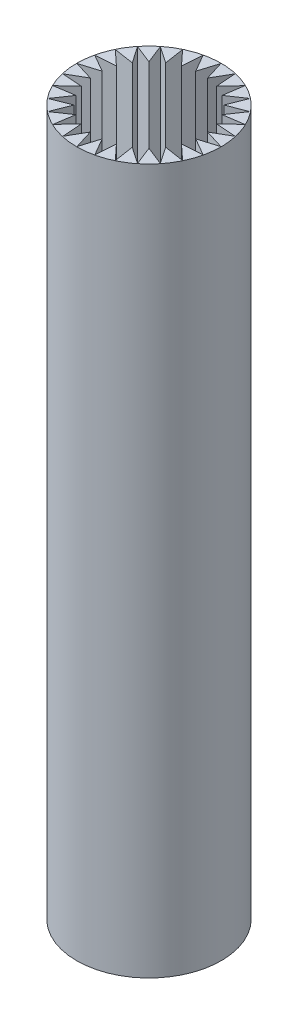
from build123d import *

# Parameters (mm, degrees)
SKETCH1_R           = 3.175
BOSS_EXTRUDE1_DEPTH = 18.000000068
SKETCH2_R           = 3.175
BOSS_EXTRUDE2_DEPTH = 0.254
SKETCH4_R           = 3.175
BOSS_EXTRUDE3_DEPTH = 12.7
CUT_EXTRUDE3_DEPTH  = 12.7


with BuildPart() as part:
    # Sketch1 → Boss-Extrude1 (new body)
    with BuildSketch(Plane(origin=(0, 0, 0), x_dir=(1, 0, 0), z_dir=(0, 1, 0))):
        with Locations(Location((0, 0, 0), (0, 0, 270))):
            Circle(SKETCH1_R)
        with BuildLine():
            Line((-1.855488288, -1.67829283), (1.855488288, -1.67829283))
            ThreePointArc((1.855488288, -1.67829283), (0, 2.5019), (-1.855488288, -1.67829283))
        make_face(mode=Mode.SUBTRACT)
    extrude(amount=BOSS_EXTRUDE1_DEPTH)

    # Sketch2 → Boss-Extrude2 (add)
    with BuildSketch(Plane(origin=(0, 18.000000068, 0), x_dir=(1, 0, 0), z_dir=(0, 1, 0))):
        with Locations(Location((0, 0, 0), (0, 0, 270))):
            Circle(SKETCH2_R)
    extrude(amount=BOSS_EXTRUDE2_DEPTH)

    # Sketch4 → Boss-Extrude3 (add)
    with BuildSketch(Plane(origin=(0, 18.254000068, 0), x_dir=(1, 0, 0), z_dir=(0, 1, 0))):
        with Locations(Location((0, 0, 0), (0, 0, 270))):
            Circle(SKETCH4_R)
    extrude(amount=BOSS_EXTRUDE3_DEPTH)

    # Sketch5 → Cut-Extrude3 (cut)
    with BuildSketch(Plane(origin=(0, 30.954000068, 0), x_dir=(1, 0, 0), z_dir=(0, 1, 0))):
        Polygon((0.703027733, 3.08016575), (0.260735719, 2.314093511), (0, 3.159377952), (-0.260735719, 2.314093511), (-0.703027733, 3.08016575), (-0.76913278, 2.1980552), (-1.370802719, 2.846501177), (-1.238962311, 1.971797222), (-1.969839933, 2.470101148), (-1.646665099, 1.646665099), (-2.470101148, 1.969839933), (-1.971797222, 1.238962311), (-2.846501177, 1.370802719), (-2.1980552, 0.76913278), (-3.08016575, 0.703027733), (-2.314093511, 0.260735719), (-3.159377952, 0), (-2.314093511, -0.260735719), (-3.08016575, -0.703027733), (-2.1980552, -0.76913278), (-2.846501177, -1.370802719), (-1.971797222, -1.238962311), (-2.470101148, -1.969839933), (-1.646665099, -1.646665099), (-1.969839933, -2.470101148), (-1.238962311, -1.971797222), (-1.370802719, -2.846501177), (-0.76913278, -2.1980552), (-0.703027733, -3.08016575), (-0.260735719, -2.314093511), (0, -3.159377952), (0.260735719, -2.314093511), (0.703027733, -3.08016575), (0.76913278, -2.1980552), (1.370802719, -2.846501177), (1.238962311, -1.971797222), (1.969839933, -2.470101148), (1.646665099, -1.646665099), (2.470101148, -1.969839933), (1.971797222, -1.238962311), (2.846501177, -1.370802719), (2.1980552, -0.76913278), (3.08016575, -0.703027733), (2.314093511, -0.260735719), (3.159377952, 0), (2.314093511, 0.260735719), (3.08016575, 0.703027733), (2.1980552, 0.76913278), (2.846501177, 1.370802719), (1.971797222, 1.238962311), (2.470101148, 1.969839933), (1.646665099, 1.646665099), (1.969839933, 2.470101148), (1.238962311, 1.971797222), (1.370802719, 2.846501177), (0.76913278, 2.1980552), align=None)
    extrude(amount=-CUT_EXTRUDE3_DEPTH, mode=Mode.SUBTRACT)


solid = part.part
